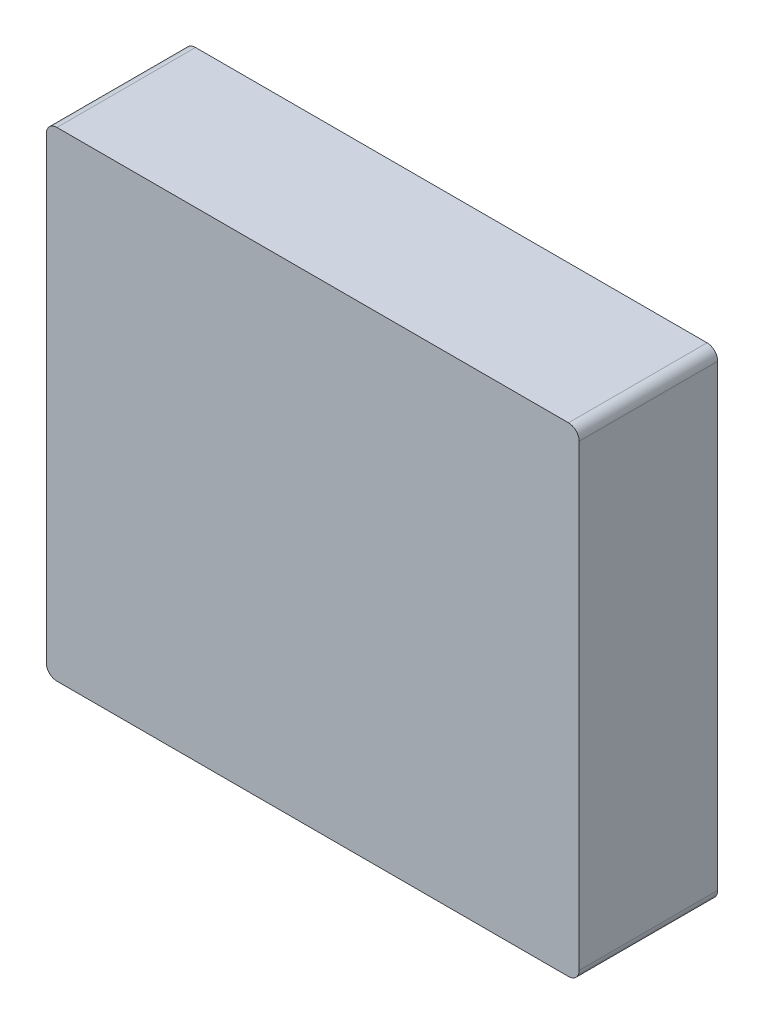
from build123d import *

# Parameters (mm, degrees)
EXTRUDE_1_DEPTH     = 26
SKETCH_2_W          = 95
SKETCH_2_H          = 85
CUT_EXTRUDE_1_DEPTH = 23
SKETCH_3_W          = 96
SKETCH_3_H          = 86
CUT_EXTRUDE_2_DEPTH = 23
FILLET_1_R          = 1
FILLET_2_R          = 0.5


with BuildPart() as part:
    # Эскиз1 → Бобышка-Вытянуть1 (new body)
    with BuildSketch(Plane.XY):
        with BuildLine():
            Line((-48, -45), (48, -45))
            ThreePointArc((48, -45), (49.414213562, -44.414213562), (50, -43))
            Line((50, -43), (50, 43))
            ThreePointArc((50, 43), (49.414213562, 44.414213562), (48, 45))
            Line((48, 45), (-48, 45))
            ThreePointArc((-48, 45), (-49.414213562, 44.414213562), (-50, 43))
            Line((-50, 43), (-50, -43))
            ThreePointArc((-50, -43), (-49.414213562, -44.414213562), (-48, -45))
        make_face()
    extrude(amount=EXTRUDE_1_DEPTH)

    # Эскиз2 → Вырез-Вытянуть1 (cut)
    with BuildSketch(Plane(origin=(0, 0, 0), x_dir=(-1, 0, 0), z_dir=(0, 0, -1))):
        Rectangle(SKETCH_2_W, SKETCH_2_H)
    extrude(amount=-CUT_EXTRUDE_1_DEPTH, mode=Mode.SUBTRACT)

    # Эскиз3 → Вырез-Вытянуть2 (cut)
    with BuildSketch(Plane(origin=(0, 0, 0), x_dir=(-1, 0, 0), z_dir=(0, 0, -1))):
        Rectangle(SKETCH_3_W, SKETCH_3_H)
    extrude(amount=-CUT_EXTRUDE_2_DEPTH, mode=Mode.SUBTRACT)

    # Скругление1
    fillet_1_edges = [part.edges().sort_by_distance(p)[0] for p in [
        (48, 0, 23),
        (0, 43, 23),
        (-48, 0, 23),
        (0, -43, 23),
    ]]
    fillet(fillet_1_edges, radius=FILLET_1_R)

    # Скругление2
    fillet_2_edges = [part.edges().sort_by_distance(p)[0] for p in [
        (48, 0, 0),
        (0, -43, 0),
        (-48, 0, 0),
        (0, 43, 0),
    ]]
    fillet(fillet_2_edges, radius=FILLET_2_R)


solid = part.part
